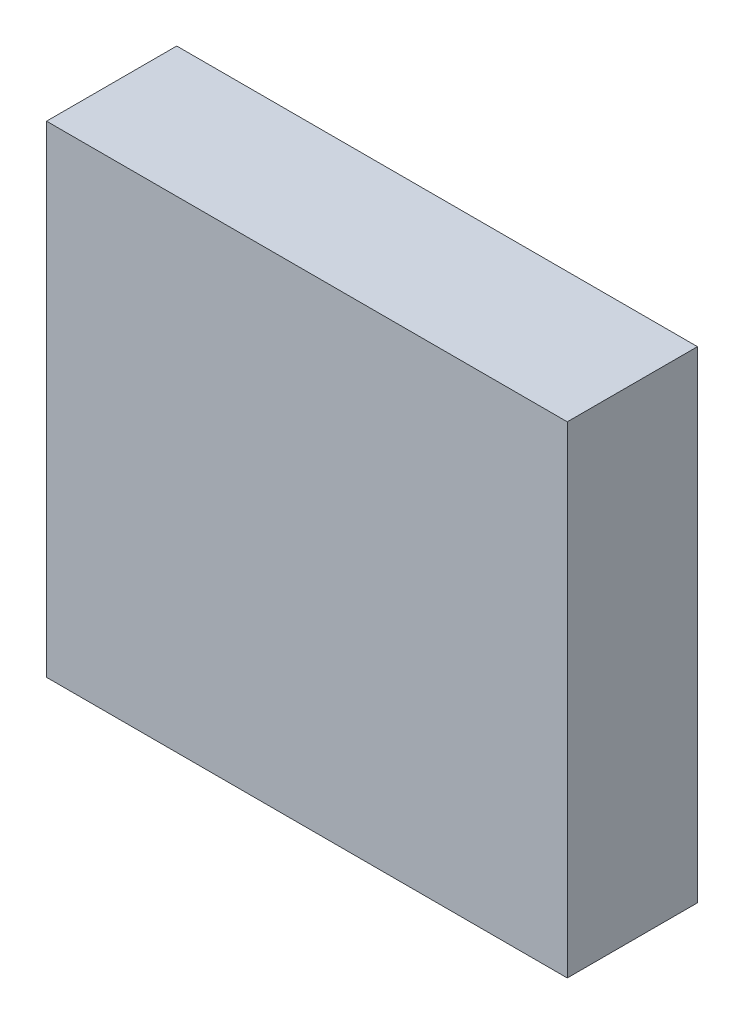
from build123d import *

# Parameters (mm, degrees)
SKETCH1_W           = 40
SKETCH1_H           = 37
BOSS_EXTRUDE1_DEPTH = 10


with BuildPart() as part:
    # Sketch1 → Boss-Extrude1 (new body)
    with BuildSketch(Plane.XY):
        with Locations((20, 18.5)):
            Rectangle(SKETCH1_W, SKETCH1_H)
    extrude(amount=-BOSS_EXTRUDE1_DEPTH)


solid = part.part
